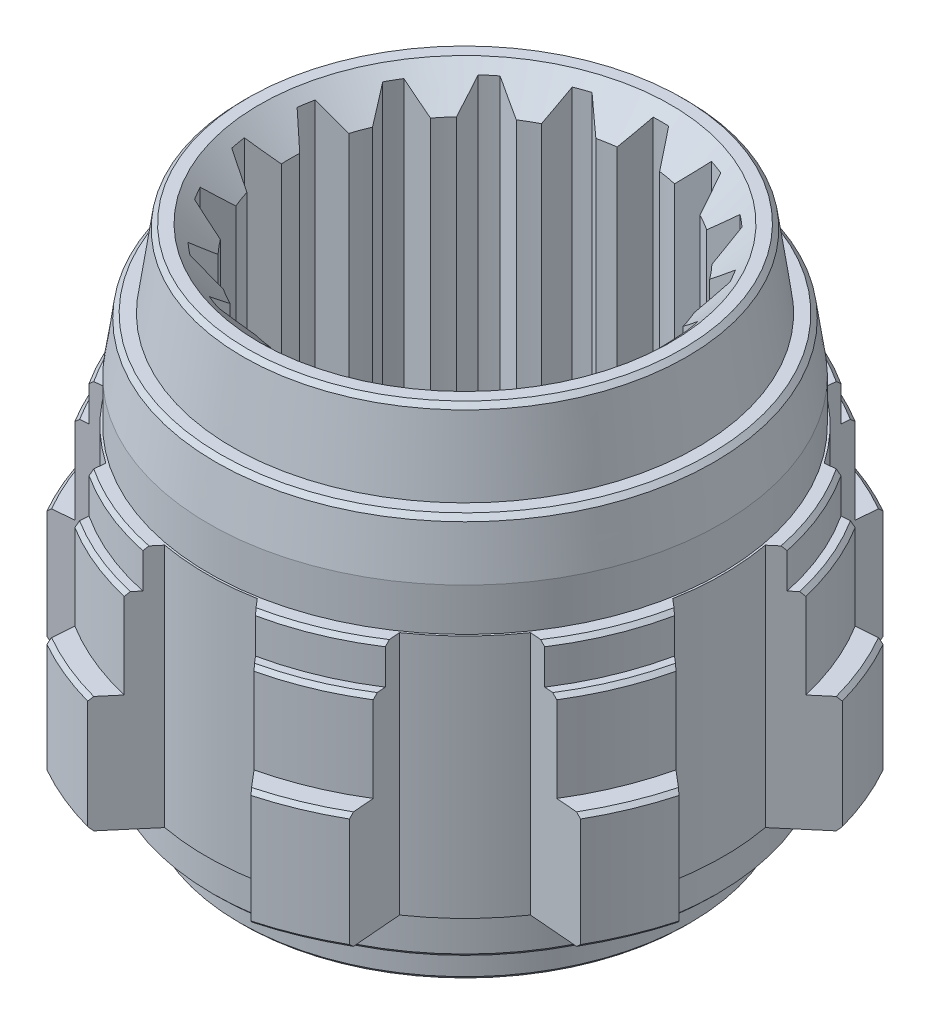
from build123d import *
from OCP.BRepFilletAPI import BRepFilletAPI_MakeChamfer

# Parameters (mm, degrees)
CHANFRO1_SIZE         = 4
CHANFRO2_SIZE         = 4
CORTE_EXTRUS_O1_DEPTH = 84.872090147
CORTE_EXTRUS_O2_DEPTH = 90.227846903
CHANFRO3_SIZE         = 0.5
CHANFRO3_SIZE2        = 0.589255651
CHANFRO4_SIZE         = 0.5
CHANFRO5_SIZE         = 0.5
FILETE1_R             = 0.5


with BuildPart() as part:
    # Esboço1 → Revolução1 (revolve)
    with BuildSketch(Plane.XY, mode=Mode.PRIVATE) as revolu_o1_sk:
        Polygon((33.579417807, 39.933198396), (39.579417807, 39.933198396), (41.007989235, 29.933198396), (43.079417807, 29.933198396), (44.079417807, 22.933198396), (44.079417807, 17.433198396), (46.079417807, 17.433198396), (46.079417807, 12.433198396), (47.579417807, 12.433198396), (47.579417807, 0.933198396), (50.579417807, 0.933198396), (50.579417807, -14.066801604), (43.579417807, -14.066801604), (43.579417807, -19.066801604), (40.079417807, -19.066801604), (40.079417807, -24.066801604), (33.579417807, -24.066801604), align=None)
    revolve(revolu_o1_sk.sketch.rotate(Axis((11.079417807, -43.667177543, 0), (0, 1, 0)), 90), axis=Axis((11.079417807, -43.667177543, 0), (0, 1, 0)))

    # Chanfro1
    chanfro1_edges = [part.edges().sort_by_distance(p)[0] for p in [
        (11.079417807, 39.933198396, 22.5),
    ]]
    chamfer(chanfro1_edges, length=CHANFRO1_SIZE)

    # Chanfro2
    chanfro2_edges = [part.edges().sort_by_distance(p)[0] for p in [
        (11.079417807, -24.066801604, 22.5),
    ]]
    chamfer(chanfro2_edges, length=CHANFRO2_SIZE)

    # Esboço2 → Corte-extrusão1 (cut, through all)
    with BuildSketch(Plane.XZ.offset(14.066801604)):
        with BuildLine():
            Line((17.042087845, 32.710993045), (21.598692286, 38.073545467))
            ThreePointArc((21.598692286, 38.073545467), (11.079417807, 39.5), (0.560143327, 38.073545467))
            Line((0.560143327, 38.073545467), (5.116747769, 32.710993045))
            ThreePointArc((5.116747769, 32.710993045), (11.079417807, 33.25), (17.042087845, 32.710993045))
        make_face()
        with BuildLine():
            Line((-7.834502777, 27.34640942), (-8.404394059, 34.360312501))
            ThreePointArc((-8.404394059, 34.360312501), (-16.85130005, 27.930717857), (-23.280894694, 19.483811866))
            Line((-23.280894694, 19.483811866), (-16.266991613, 18.913920584))
            ThreePointArc((-16.266991613, 18.913920584), (-12.431882668, 23.511300474), (-7.834502777, 27.34640942))
        make_face()
        with BuildLine():
            Line((-21.631575239, 5.962670038), (-26.99412766, 10.519274479))
            ThreePointArc((-26.99412766, 10.519274479), (-28.420582193, 0), (-26.99412766, -10.519274479))
            Line((-26.99412766, -10.519274479), (-21.631575239, -5.962670038))
            ThreePointArc((-21.631575239, -5.962670038), (-22.170582193, 0), (-21.631575239, 5.962670038))
        make_face()
        with BuildLine():
            Line((-16.266991613, -18.913920584), (-23.280894694, -19.483811866))
            ThreePointArc((-23.280894694, -19.483811866), (-16.85130005, -27.930717857), (-8.404394059, -34.360312501))
            Line((-8.404394059, -34.360312501), (-7.834502777, -27.34640942))
            ThreePointArc((-7.834502777, -27.34640942), (-12.431882668, -23.511300474), (-16.266991613, -18.913920584))
        make_face()
        with BuildLine():
            ThreePointArc((0.560143327, -38.073545467), (11.079417807, -39.5), (21.598692286, -38.073545467))
            Line((21.598692286, -38.073545467), (17.042087845, -32.710993045))
            ThreePointArc((17.042087845, -32.710993045), (11.079417807, -33.25), (5.116747769, -32.710993045))
            Line((5.116747769, -32.710993045), (0.560143327, -38.073545467))
        make_face()
        with BuildLine():
            ThreePointArc((30.563229673, -34.360312501), (39.010135664, -27.930717857), (45.439730308, -19.483811866))
            Line((45.439730308, -19.483811866), (38.425827226, -18.913920584))
            ThreePointArc((38.425827226, -18.913920584), (34.590718281, -23.511300474), (29.993338391, -27.34640942))
            Line((29.993338391, -27.34640942), (30.563229673, -34.360312501))
        make_face()
        with BuildLine():
            ThreePointArc((50.579417807, 0), (50.221179686, 5.307775148), (49.152963274, 10.519274479))
            Line((49.152963274, 10.519274479), (43.790410852, 5.962670038))
            ThreePointArc((43.790410852, 5.962670038), (44.194391903, 2.993491376), (44.329417807, 0))
            ThreePointArc((44.329417807, 0), (44.194391903, -2.993491376), (43.790410852, -5.962670038))
            Line((43.790410852, -5.962670038), (49.152963274, -10.519274479))
            ThreePointArc((49.152963274, -10.519274479), (50.221179686, -5.307775148), (50.579417807, 0))
        make_face()
        with BuildLine():
            ThreePointArc((30.563229673, 34.360312501), (39.010135664, 27.930717857), (45.439730308, 19.483811866))
            Line((45.439730308, 19.483811866), (38.425827226, 18.913920584))
            ThreePointArc((38.425827226, 18.913920584), (34.590718281, 23.511300474), (29.993338391, 27.34640942))
            Line((29.993338391, 27.34640942), (30.563229673, 34.360312501))
        make_face()
    extrude(amount=-CORTE_EXTRUS_O1_DEPTH, mode=Mode.SUBTRACT)

    # Esboço3 → Corte-extrusão2 (cut, through all)
    with BuildSketch(Plane.XZ.offset(24.066801604)):
        with BuildLine():
            Line((10.081066848, 25.230255555), (8.345600916, 22.333299022))
            ThreePointArc((8.345600916, 22.333299022), (11.079417807, 22.5), (13.813234698, 22.333299022))
            Line((13.813234698, 22.333299022), (12.077768766, 25.230255555))
            ThreePointArc((12.077768766, 25.230255555), (11.079417807, 25.25), (10.081066848, 25.230255555))
        make_face()
        with BuildLine():
            Line((18.770530399, 24.050141104), (16.14890838, 21.921456734))
            ThreePointArc((16.14890838, 21.921456734), (18.774871032, 21.143083968), (21.286803498, 20.051415844))
            Line((21.286803498, 20.051415844), (20.646816457, 23.367228827))
            ThreePointArc((20.646816457, 23.367228827), (19.715426426, 23.727238675), (18.770530399, 24.050141104))
        make_face()
        with BuildLine():
            Line((26.532332262, 19.969224693), (23.340760464, 18.865563237))
            ThreePointArc((23.340760464, 18.865563237), (25.542139025, 17.23599997), (27.529210939, 15.351035988))
            Line((27.529210939, 15.351035988), (28.061894671, 18.68576944))
            ThreePointArc((28.061894671, 18.68576944), (27.309804951, 19.342622189), (26.532332262, 19.969224693))
        make_face()
        with BuildLine():
            Line((32.430284582, 13.47972507), (29.053713665, 13.534204388))
            ThreePointArc((29.053713665, 13.534204388), (30.564989392, 11.25), (31.787530556, 8.799094634))
            Line((31.787530556, 8.799094634), (33.428635541, 11.750530485))
            ThreePointArc((33.428635541, 11.750530485), (32.946559252, 12.625), (32.430284582, 13.47972507))
        make_face()
        with BuildLine():
            Line((35.753007263, 5.364371664), (32.598701513, 6.570420746))
            ThreePointArc((32.598701513, 6.570420746), (33.23759225, 3.907083997), (33.548146155, 1.185852607))
            Line((33.548146155, 1.185852607), (36.099730912, 3.398004134))
            ThreePointArc((36.099730912, 3.398004134), (35.94581357, 4.384616486), (35.753007263, 5.364371664))
        make_face()
        with BuildLine():
            Line((36.099730912, -3.398004135), (33.548146155, -1.185852607))
            ThreePointArc((33.548146155, -1.185852607), (33.23759225, -3.907083998), (32.598701513, -6.570420746))
            Line((32.598701513, -6.570420746), (35.753007263, -5.364371664))
            ThreePointArc((35.753007263, -5.364371664), (35.94581357, -4.384616486), (36.099730912, -3.398004135))
        make_face()
        with BuildLine():
            Line((33.428635541, -11.750530485), (31.787530556, -8.799094634))
            ThreePointArc((31.787530556, -8.799094634), (30.564989392, -11.25), (29.053713665, -13.534204388))
            Line((29.053713665, -13.534204388), (32.430284582, -13.47972507))
            ThreePointArc((32.430284582, -13.47972507), (32.946559252, -12.625), (33.428635541, -11.750530485))
        make_face()
        with BuildLine():
            Line((28.061894671, -18.68576944), (27.529210939, -15.351035988))
            ThreePointArc((27.529210939, -15.351035988), (25.542139025, -17.23599997), (23.340760464, -18.865563237))
            Line((23.340760464, -18.865563237), (26.532332262, -19.969224693))
            ThreePointArc((26.532332262, -19.969224693), (27.309804951, -19.342622189), (28.061894671, -18.68576944))
        make_face()
        with BuildLine():
            Line((20.646816457, -23.367228827), (21.286803498, -20.051415844))
            ThreePointArc((21.286803498, -20.051415844), (18.774871032, -21.143083968), (16.14890838, -21.921456734))
            Line((16.14890838, -21.921456734), (18.770530399, -24.050141104))
            ThreePointArc((18.770530399, -24.050141104), (19.715426426, -23.727238675), (20.646816457, -23.367228827))
        make_face()
        with BuildLine():
            Line((12.077768766, -25.230255555), (13.813234698, -22.333299022))
            ThreePointArc((13.813234698, -22.333299022), (11.079417807, -22.5), (8.345600916, -22.333299022))
            Line((8.345600916, -22.333299022), (10.081066848, -25.230255555))
            ThreePointArc((10.081066848, -25.230255555), (11.079417807, -25.25), (12.077768766, -25.230255555))
        make_face()
        with BuildLine():
            Line((3.388305215, -24.050141104), (6.009927233, -21.921456734))
            ThreePointArc((6.009927233, -21.921456734), (3.383964582, -21.143083968), (0.872032115, -20.051415844))
            Line((0.872032115, -20.051415844), (1.512019157, -23.367228827))
            ThreePointArc((1.512019157, -23.367228827), (2.443409188, -23.727238675), (3.388305215, -24.050141104))
        make_face()
        with BuildLine():
            Line((-4.373496649, -19.969224693), (-1.18192485, -18.865563237))
            ThreePointArc((-1.18192485, -18.865563237), (-3.383303411, -17.23599997), (-5.370375326, -15.351035988))
            Line((-5.370375326, -15.351035988), (-5.903059058, -18.68576944))
            ThreePointArc((-5.903059058, -18.68576944), (-5.150969338, -19.342622189), (-4.373496649, -19.969224693))
        make_face()
        with BuildLine():
            Line((-10.271448968, -13.47972507), (-6.894878051, -13.534204388))
            ThreePointArc((-6.894878051, -13.534204388), (-8.406153778, -11.25), (-9.628694942, -8.799094634))
            Line((-9.628694942, -8.799094634), (-11.269799927, -11.750530485))
            ThreePointArc((-11.269799927, -11.750530485), (-10.787723639, -12.625), (-10.271448968, -13.47972507))
        make_face()
        with BuildLine():
            Line((-13.594171649, -5.364371664), (-10.439865899, -6.570420746))
            ThreePointArc((-10.439865899, -6.570420746), (-11.078756636, -3.907083998), (-11.389310542, -1.185852607))
            Line((-11.389310542, -1.185852607), (-13.940895299, -3.398004135))
            ThreePointArc((-13.940895299, -3.398004135), (-13.786977957, -4.384616486), (-13.594171649, -5.364371664))
        make_face()
        with BuildLine():
            Line((-13.940895299, 3.398004134), (-11.389310542, 1.185852607))
            ThreePointArc((-11.389310542, 1.185852607), (-11.078756636, 3.907083997), (-10.439865899, 6.570420746))
            Line((-10.439865899, 6.570420746), (-13.594171649, 5.364371664))
            ThreePointArc((-13.594171649, 5.364371664), (-13.786977957, 4.384616486), (-13.940895299, 3.398004134))
        make_face()
        with BuildLine():
            Line((-11.269799927, 11.750530485), (-9.628694942, 8.799094634))
            ThreePointArc((-9.628694942, 8.799094634), (-8.406153778, 11.25), (-6.894878051, 13.534204388))
            Line((-6.894878051, 13.534204388), (-10.271448968, 13.47972507))
            ThreePointArc((-10.271448968, 13.47972507), (-10.787723639, 12.625), (-11.269799927, 11.750530485))
        make_face()
        with BuildLine():
            Line((-5.903059058, 18.68576944), (-5.370375326, 15.351035988))
            ThreePointArc((-5.370375326, 15.351035988), (-3.383303411, 17.23599997), (-1.18192485, 18.865563237))
            Line((-1.18192485, 18.865563237), (-4.373496649, 19.969224693))
            ThreePointArc((-4.373496649, 19.969224693), (-5.150969338, 19.342622189), (-5.903059058, 18.68576944))
        make_face()
        with BuildLine():
            Line((1.512019157, 23.367228827), (0.872032115, 20.051415844))
            ThreePointArc((0.872032115, 20.051415844), (3.383964582, 21.143083968), (6.009927233, 21.921456734))
            Line((6.009927233, 21.921456734), (3.388305215, 24.050141104))
            ThreePointArc((3.388305215, 24.050141104), (2.443409188, 23.727238675), (1.512019157, 23.367228827))
        make_face()
    extrude(amount=-CORTE_EXTRUS_O2_DEPTH, mode=Mode.SUBTRACT)

    # Chanfro3: one chamfer whose edges measure the first distance from different faces: ONE call of the kernel's chamfer builder (chamfer() names one face for all edges)
    chanfro3_edges_1 = [part.edges().sort_by_distance(p)[0] for p in [
        (-4.036577772, -14.066801604, -36.493241534),
        (-2.314502326, 17.433198396, -32.335783638),
        (-4.036577772, 0.933198396, -36.493241534),
        (-2.888527475, 12.433198396, -33.721602937),
        (26.195413385, -14.066801604, -36.493241534),
        (24.47333794, 17.433198396, -32.335783638),
        (26.195413385, 0.933198396, -36.493241534),
        (25.047363088, 12.433198396, -33.721602937),
        (47.572659341, -14.066801604, -15.115995578),
        (43.415201445, 17.433198396, -13.393920133),
        (47.572659341, 0.933198396, -15.115995578),
        (44.801020743, 12.433198396, -13.967945281),
        (43.415201445, 17.433198396, 13.393920133),
        (47.572659341, 0.933198396, 15.115995578),
        (44.801020743, 12.433198396, 13.967945281),
        (-25.413823727, -14.066801604, -15.115995578),
        (-21.256365831, 17.433198396, -13.393920133),
        (-25.413823727, 0.933198396, -15.115995578),
        (-22.64218513, 12.433198396, -13.967945281),
    ]]
    chanfro3_edges_2 = [part.edges().sort_by_distance(p)[0] for p in [
        (11.079417807, 29.933198396, 32),
    ]]
    chanfro3_side_2 = [part.faces().sort_by_distance(p)[0] for p in [
        (11.079417807, 29.933198396, 30.833668108),
    ]]
    chanfro3_edges_3 = [part.edges().sort_by_distance(p)[0] for p in [
        (11.079417807, 39.933198396, 28.5),
    ]]
    chanfro3_side_3 = [part.faces().sort_by_distance(p)[0] for p in [
        (11.079417807, 39.933198396, 27.306101731),
    ]]
    chanfro3 = BRepFilletAPI_MakeChamfer(part.part.solid().wrapped)
    for e in chanfro3_edges_1:
        chanfro3.Add(CHANFRO3_SIZE, e.wrapped)
    for e in chanfro3_edges_2:
        chanfro3.Add(CHANFRO3_SIZE, CHANFRO3_SIZE2, e.wrapped, chanfro3_side_2[0].wrapped)  # the first distance lies on this face
    for e in chanfro3_edges_3:
        chanfro3.Add(CHANFRO3_SIZE, CHANFRO3_SIZE2, e.wrapped, chanfro3_side_3[0].wrapped)  # the first distance lies on this face
    add(Compound.cast(chanfro3.Shape()), mode=Mode.REPLACE)

    # Chanfro4
    chanfro4_edges = [part.edges().sort_by_distance(p)[0] for p in [
        (47.572659341, -14.066801604, 15.115995578),
        (26.195413385, -14.066801604, 36.493241534),
        (24.47333794, 17.433198396, 32.335783638),
        (26.195413385, 0.933198396, 36.493241534),
        (25.047363088, 12.433198396, 33.721602937),
        (-4.036577772, -14.066801604, 36.493241534),
        (-4.036577772, 0.933198396, 36.493241534),
        (-2.888527475, 12.433198396, 33.721602937),
        (-2.314502326, 17.433198396, 32.335783638),
        (-25.413823727, -14.066801604, 15.115995578),
        (-25.413823727, 0.933198396, 15.115995578),
        (-22.64218513, 12.433198396, 13.967945281),
        (-21.256365831, 17.433198396, 13.393920133),
    ]]
    chamfer(chanfro4_edges, length=CHANFRO4_SIZE)

    # Chanfro5
    chanfro5_edges = [part.edges().sort_by_distance(p)[0] for p in [
        (11.079417807, -24.066801604, 29),
        (11.079417807, -19.066801604, 32.5),
    ]]
    chamfer(chanfro5_edges, length=CHANFRO5_SIZE)

    # Filete1
    filete1_edges = [part.edges().sort_by_distance(p)[0] for p in [
        (11.079417807, -19.066801604, 29),
        (11.079417807, -14.066801604, 32.5),
    ]]
    fillet(filete1_edges, radius=FILETE1_R)


solid = part.part
